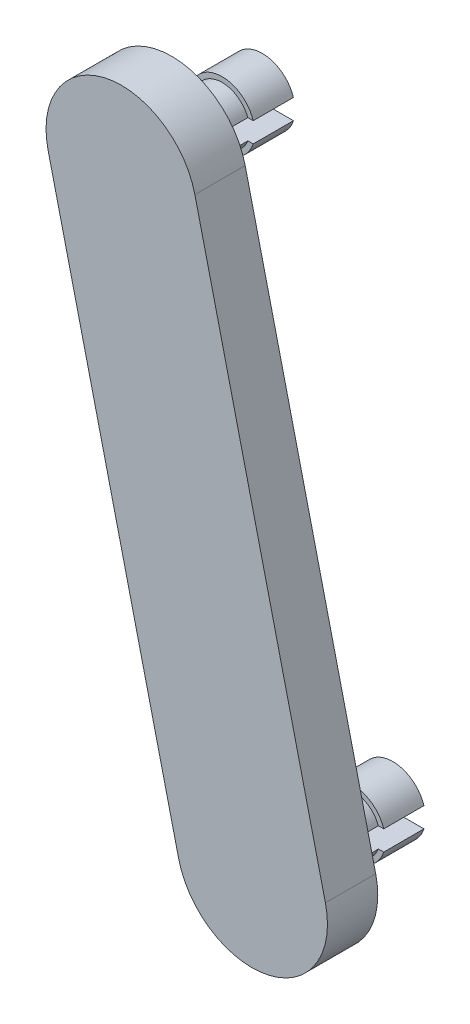
from build123d import *

# Parameters (mm, degrees)
BOSS_EXTRU_1_DEPTH      = 5
ESQUISSE3_R             = 2.75
BOSS_EXTRU_2_DEPTH      = 5
ESQUISSE4_R             = 3.25
BOSS_EXTRU_3_DEPTH      = 4
ESQUISSE5_W             = 10
ESQUISSE5_H             = 2
ENL_V_MAT_EXTRU_1_DEPTH = 9


with BuildPart() as part:
    # Esquisse1 → Boss.-Extru.1 (new body)
    with BuildSketch(Plane.XY):
        with BuildLine():
            Line((-111.881065478, -43.864420881), (-124.856118958, 10.611702211))
            ThreePointArc((-124.856118958, 10.611702211), (-119.297939992, 19.645341931), (-110.264300273, 14.087162965))
            Line((-110.264300273, 14.087162965), (-97.289246792, -40.388960128))
            ThreePointArc((-97.289246792, -40.388960128), (-102.847425758, -49.422599847), (-111.881065478, -43.864420881))
        make_face()
    extrude(amount=BOSS_EXTRU_1_DEPTH)

    # Esquisse3 → Boss.-Extru.2 (add)
    with BuildSketch(Plane.XY):
        with Locations((-117.560209615, 12.349432588)):
            Circle(ESQUISSE3_R)
        with Locations((-104.585156135, -42.126690504)):
            Circle(ESQUISSE3_R)
    extrude(amount=-BOSS_EXTRU_2_DEPTH)

    # Esquisse4 → Boss.-Extru.3 (add)
    with BuildSketch(Plane(origin=(0, 0, -5), x_dir=(-1, 0, 0), z_dir=(0, 0, -1))):
        with Locations((117.560209615, 12.349432588)):
            Circle(ESQUISSE4_R)
        with Locations((104.585156135, -42.126690504)):
            Circle(ESQUISSE4_R)
    extrude(amount=BOSS_EXTRU_3_DEPTH)

    # Esquisse5 → Enlèv. mat.-Extru.1 (cut)
    with BuildSketch(Plane(origin=(0, 0, -9), x_dir=(-1, 0, 0), z_dir=(0, 0, -1))):
        with Locations((104.585156135, -42.126690504)):
            Rectangle(ESQUISSE5_W, ESQUISSE5_H)
        with Locations((117.560209615, 12.349432588)):
            Rectangle(ESQUISSE5_W, ESQUISSE5_H)
    extrude(amount=-ENL_V_MAT_EXTRU_1_DEPTH, mode=Mode.SUBTRACT)


solid = part.part
